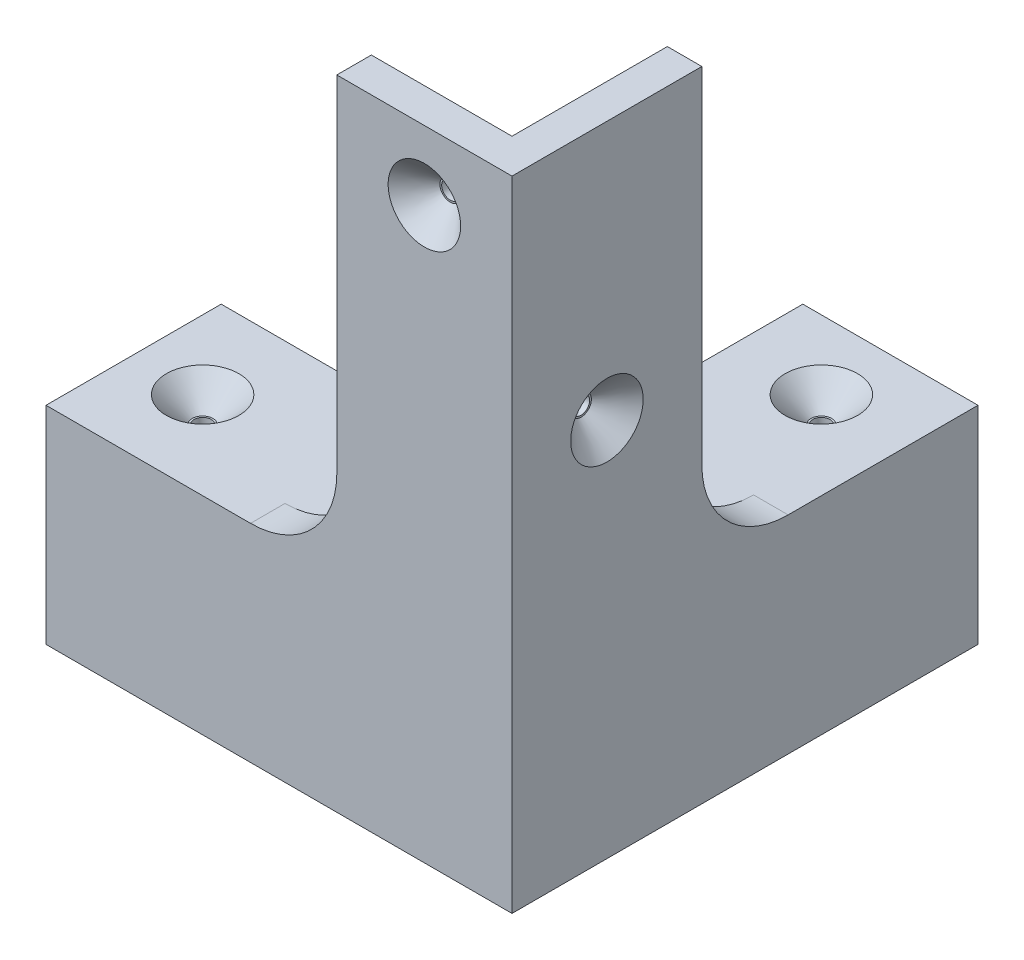
from build123d import *

# Parameters (mm, degrees)
SKETCH1_W                    = 33.7
SKETCH1_H                    = 20.3
SKETCH1_W_2                  = 20.3
SKETCH1_H_2                  = 33.7
BOSS_EXTRUDE1_DEPTH          = 24
SHELL1_T                     = -4
SKETCH2_R                    = 1
CUT_EXTRUDE1_DEPTH           = 24
SKETCH3_R                    = 4.2
CUT_EXTRUDE2_DEPTH           = 3
CUT_EXTRUDE2_DRAFT           = -45
CUT_EXTRUDE2_PROFILE_2_DEPTH = 3
CUT_EXTRUDE2_PROFILE_2_DRAFT = -45
SKETCH4_W                    = 20.3
SKETCH4_H                    = 22
BOSS_EXTRUDE2_DEPTH          = 50
SHELL2_T                     = -4
CUT_EXTRUDE3_REACH           = 93.28
SKETCH5_R                    = 1
SKETCH6_R                    = 4.2
CUT_EXTRUDE4_DEPTH           = 3
CUT_EXTRUDE4_DRAFT           = -45
CUT_EXTRUDE5_REACH           = 93.28
SKETCH7_R                    = 1
SKETCH8_R                    = 4.2
CUT_EXTRUDE6_DEPTH           = 3
CUT_EXTRUDE6_DRAFT           = -45
FILLET1_R                    = 10


with BuildPart() as part:
    # Sketch1 → Boss-Extrude1 (new body)
    with BuildSketch(Plane(origin=(0, 0, 0), x_dir=(1, 0, 0), z_dir=(0, 1, 0))):
        with Locations((-37.15, 10.15)):
            Rectangle(SKETCH1_W, SKETCH1_H)
        with Locations((-10.15, 10.15)):
            Rectangle(SKETCH1_W_2, SKETCH1_H)
        with Locations((-10.15, 37.15)):
            Rectangle(SKETCH1_W_2, SKETCH1_H_2)
    extrude(amount=-BOSS_EXTRUDE1_DEPTH)

    # Shell1
    shell1_openings = [part.faces().sort_by_distance(p)[0] for p in [
        (-53.236324676, -24, -10.15),
        (-54, -12, -10.15),
        (-37.15, -12, -20.3),
        (-20.3, -12, -37.15),
        (-10.15, -12, -54),
    ]]
    offset(amount=SHELL1_T, openings=shell1_openings, kind=Kind.INTERSECTION)

    # Sketch2 → Cut-Extrude1 (cut)
    with BuildSketch(Plane(origin=(0, 0, 0), x_dir=(1, 0, 0), z_dir=(0, 1, 0))):
        with Locations(Location((-10.15, 46, 0), (0, 0, 270))):
            Circle(SKETCH2_R)
        with Locations(Location((-46, 10.15, 0), (0, 0, 270))):
            Circle(SKETCH2_R)
    extrude(amount=-CUT_EXTRUDE1_DEPTH, mode=Mode.SUBTRACT)


with BuildPart() as cut_extrude2_tool:
    # Sketch3 → Cut-Extrude2 (with draft: the straight prism first)
    with BuildSketch(Plane(origin=(0, 0, 0), x_dir=(1, 0, 0), z_dir=(0, 1, 0))):
        with Locations((-46, 10.15)):
            Circle(SKETCH3_R)
    extrude(amount=-CUT_EXTRUDE2_DEPTH)
    # Cut-Extrude2: the draft: its side faces are tilted about the plane it starts from
    cut_extrude2_sides = [cut_extrude2_tool.faces().sort_by_distance(p)[0] for p in [
        (-50.2, -1.5, -10.15),
    ]]
    draft(cut_extrude2_sides, Plane(origin=(0, 0, 0), x_dir=(1, 0, 0), z_dir=(0, 1, 0)), CUT_EXTRUDE2_DRAFT)


with BuildPart() as part_1:
    add(part.part)

    # Cut-Extrude2: cut by cut_extrude2_tool
    add(cut_extrude2_tool.part, mode=Mode.SUBTRACT)


with BuildPart() as cut_extrude2_profile_2_tool:
    # Sketch3 → Cut-Extrude2 profile 2 (with draft: the straight prism first)
    with BuildSketch(Plane(origin=(0, 0, 0), x_dir=(1, 0, 0), z_dir=(0, 1, 0))):
        with Locations((-10.15, 46)):
            Circle(SKETCH3_R)
    extrude(amount=-CUT_EXTRUDE2_PROFILE_2_DEPTH)
    # Cut-Extrude2 profile 2: the draft: its side faces are tilted about the plane it starts from
    cut_extrude2_profile_2_sides = [cut_extrude2_profile_2_tool.faces().sort_by_distance(p)[0] for p in [
        (-14.35, -1.5, -46),
    ]]
    draft(cut_extrude2_profile_2_sides, Plane(origin=(0, 0, 0), x_dir=(1, 0, 0), z_dir=(0, 1, 0)), CUT_EXTRUDE2_PROFILE_2_DRAFT)


with BuildPart() as part_2:
    add(part_1.part)

    # Cut-Extrude2 profile 2: cut by cut_extrude2_profile_2_tool
    add(cut_extrude2_profile_2_tool.part, mode=Mode.SUBTRACT)


with BuildPart() as body_2:
    # Sketch4 → Boss-Extrude2 (new body)
    with BuildSketch(Plane(origin=(0, 0, 0), x_dir=(1, 0, 0), z_dir=(0, 1, 0))):
        with Locations((-10.15, 11)):
            Rectangle(SKETCH4_W, SKETCH4_H)
    extrude(amount=BOSS_EXTRUDE2_DEPTH)

    # Shell2
    shell2_openings = [body_2.faces().sort_by_distance(p)[0] for p in [
        (-10.15, 50, -11),
        (-10.15, 0, -11),
        (-20.3, 25, -11),
        (-10.15, 25, -22),
    ]]
    offset(amount=SHELL2_T, openings=shell2_openings, kind=Kind.INTERSECTION)


with BuildPart() as part_3:
    add(part_2.part)

    # Combine1: union body 2
    add(body_2.part)

    # Sketch5 → Cut-Extrude3 (cut, up to next)
    with BuildSketch(Plane.XY, mode=Mode.PRIVATE) as cut_extrude3_sk1:
        with Locations((-10.15, 42)):
            Circle(SKETCH5_R)
    cut_extrude3_tool1 = extrude(cut_extrude3_sk1.sketch, amount=-CUT_EXTRUDE3_REACH, mode=Mode.PRIVATE) & part_3.part
    add(cut_extrude3_tool1.solids().sort_by_distance((-10.15, 42, 0))[0], mode=Mode.SUBTRACT)


with BuildPart() as cut_extrude4_tool:
    # Sketch6 → Cut-Extrude4 (with draft: the straight prism first)
    with BuildSketch(Plane.XY):
        with Locations((-10.15, 42)):
            Circle(SKETCH6_R)
    extrude(amount=-CUT_EXTRUDE4_DEPTH)
    # Cut-Extrude4: the draft: its side faces are tilted about the plane it starts from
    cut_extrude4_sides = [cut_extrude4_tool.faces().sort_by_distance(p)[0] for p in [
        (-14.35, 42, -1.5),
    ]]
    draft(cut_extrude4_sides, Plane.XY, CUT_EXTRUDE4_DRAFT)


with BuildPart() as part_4:
    add(part_3.part)

    # Cut-Extrude4: cut by cut_extrude4_tool
    add(cut_extrude4_tool.part, mode=Mode.SUBTRACT)

    # Sketch7 → Cut-Extrude5 (cut, up to next)
    with BuildSketch(Plane(origin=(0, 0, 0), x_dir=(0, 0, -1), z_dir=(1, 0, 0)), mode=Mode.PRIVATE) as cut_extrude5_sk1:
        with Locations((11, 20)):
            Circle(SKETCH7_R)
    cut_extrude5_tool1 = extrude(cut_extrude5_sk1.sketch, amount=-CUT_EXTRUDE5_REACH, mode=Mode.PRIVATE) & part_4.part
    add(cut_extrude5_tool1.solids().sort_by_distance((0, 20, -11))[0], mode=Mode.SUBTRACT)


with BuildPart() as cut_extrude6_tool:
    # Sketch8 → Cut-Extrude6 (with draft: the straight prism first)
    with BuildSketch(Plane(origin=(0, 0, 0), x_dir=(0, 0, -1), z_dir=(1, 0, 0))):
        with Locations((11, 20)):
            Circle(SKETCH8_R)
    extrude(amount=-CUT_EXTRUDE6_DEPTH)
    # Cut-Extrude6: the draft: its side faces are tilted about the plane it starts from
    cut_extrude6_sides = [cut_extrude6_tool.faces().sort_by_distance(p)[0] for p in [
        (-1.5, 20, -6.8),
    ]]
    draft(cut_extrude6_sides, Plane(origin=(0, 0, 0), x_dir=(0, 0, -1), z_dir=(1, 0, 0)), CUT_EXTRUDE6_DRAFT)


with BuildPart() as part_5:
    add(part_4.part)

    # Cut-Extrude6: cut by cut_extrude6_tool
    add(cut_extrude6_tool.part, mode=Mode.SUBTRACT)

    # Fillet1
    fillet1_edges = [part_5.edges().sort_by_distance(p)[0] for p in [
        (-2, 0, -22),
        (-20.3, 0, -2),
    ]]
    fillet(fillet1_edges, radius=FILLET1_R)


solid = part_5.part
